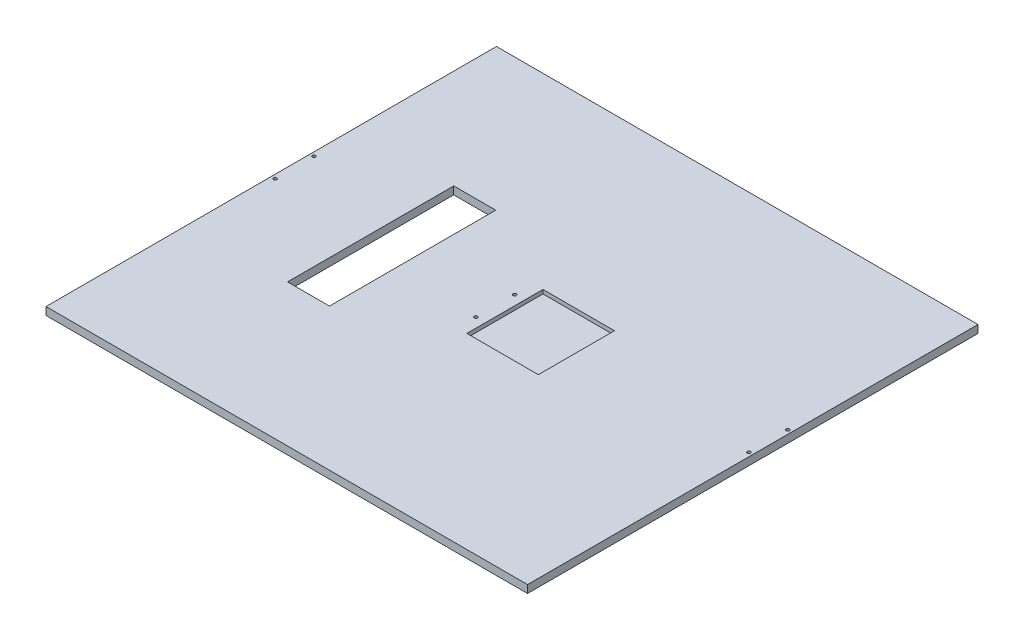
from build123d import *

# Parameters (mm, degrees)
SKETCH_1_W             = 620
SKETCH_1_H             = 580
EXTRUDE_1_DEPTH        = 10
HOLE_WIZARD_M5_1_D     = 4.2
HOLE_WIZARD_M5_1_DEPTH = 12.2
HOLE_WIZARD_M5_1_TIP   = 1.2618073
SKETCH_5_W             = 54
SKETCH_5_H             = 214
CUT_EXTRUDE_1_DEPTH    = 425.617474911
HOLE_WIZARD_M5_2_D     = 4.2
SKETCH_10_W            = 92
SKETCH_10_H            = 98
CUT_EXTRUDE_2_DEPTH    = 5


with BuildPart() as part:
    # 草图1 → 凸台-拉伸1 (new body)
    with BuildSketch(Plane(origin=(0, 0, 0), x_dir=(1, 0, 0), z_dir=(0, 1, 0))):
        Rectangle(SKETCH_1_W, SKETCH_1_H)
    extrude(amount=EXTRUDE_1_DEPTH)

    # M5 螺纹孔1
    with Locations(Plane(origin=(0, 10, 0), x_dir=(1, 0, 0), z_dir=(0, 1, 0))):
        with Locations((-305, 50), (-305, 0), (305, 0), (305, 50)):
            Hole(HOLE_WIZARD_M5_1_D / 2, depth=HOLE_WIZARD_M5_1_DEPTH)
            with Locations((0, 0, -(HOLE_WIZARD_M5_1_DEPTH + HOLE_WIZARD_M5_1_TIP / 2))):  # 118° drill point
                Cone(0, HOLE_WIZARD_M5_1_D / 2, HOLE_WIZARD_M5_1_TIP, mode=Mode.SUBTRACT)

    # 草图5 → 切除-拉伸1 (cut, through all)
    with BuildSketch(Plane.XZ):
        with Locations((-155, 0)):
            Rectangle(SKETCH_5_W, SKETCH_5_H)
    extrude(amount=-CUT_EXTRUDE_1_DEPTH, mode=Mode.SUBTRACT)

    # M5 螺纹孔2 (through all)
    with Locations(Plane(origin=(0, 0, 0), x_dir=(-1, 0, 0), z_dir=(0, -1, 0))):
        with Locations((21.6, -25), (21.6, 25)):
            Hole(HOLE_WIZARD_M5_2_D / 2)

    # 草图10 → 切除-拉伸2 (cut)
    with BuildSketch(Plane(origin=(0, 10, 0), x_dir=(1, 0, 0), z_dir=(0, 1, 0))):
        with Locations((36.9, 0)):
            Rectangle(SKETCH_10_W, SKETCH_10_H)
    extrude(amount=-CUT_EXTRUDE_2_DEPTH, mode=Mode.SUBTRACT)


solid = part.part
